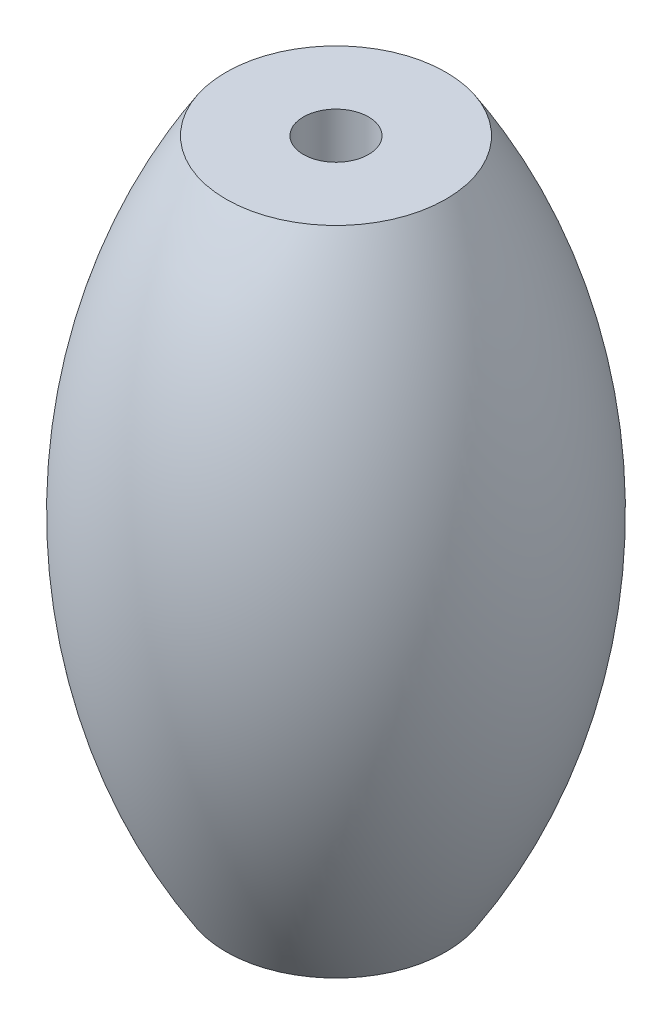
from build123d import *


with BuildPart() as part:
    # Sketch1 → Revolve1 (revolve)
    with BuildSketch(Plane.XY, mode=Mode.PRIVATE) as revolve1_sk:
        with BuildLine():
            Line((-0.75, 7.5), (-2.531209361, 7.5))
            ThreePointArc((-2.531209361, 7.5), (-4.709618943, 0), (-2.531209361, -7.5))
            Line((-2.531209361, -7.5), (-0.75, -7.5))
            Line((-0.75, -7.5), (-0.75, 7.5))
        make_face()
    revolve(revolve1_sk.sketch.rotate(Axis((0, -10.721793516, 0), (0, 1, 0)), 270), axis=Axis((0, -10.721793516, 0), (0, 1, 0)))


solid = part.part
